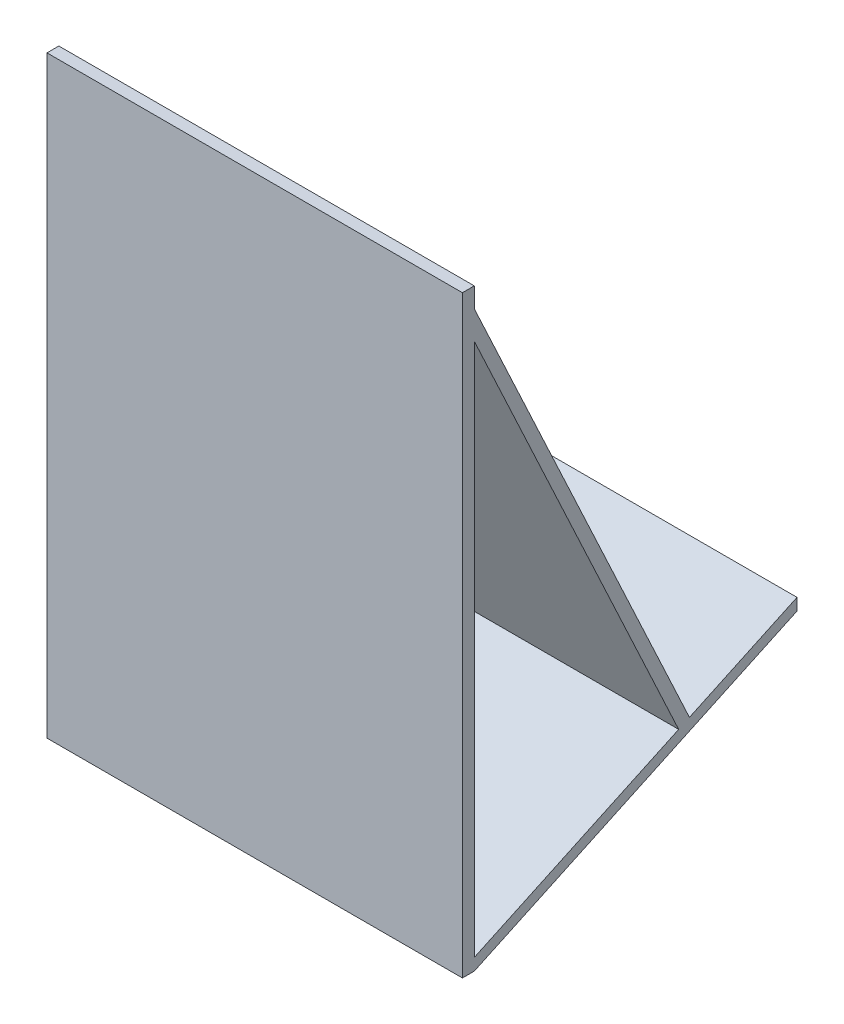
from build123d import *

# Parameters (mm, degrees)
ESBO_O2_W                = 140
ESBO_O2_H                = 200
RESSALTO_EXTRUS_O2_DEPTH = 4
ESBO_O11_W               = 2
ESBO_O11_H               = 4
RESSALTO_EXTRUS_O3_DEPTH = 69
RESSALTO_EXTRUS_O4_DEPTH = 69
ESBO_O14_W               = 140
ESBO_O14_H               = 4
RESSALTO_EXTRUS_O5_DEPTH = 175
ESBO_O17_W               = 140
ESBO_O17_H               = 6
RESSALTO_EXTRUS_O6_DEPTH = 10
ESBO_O18_W               = 140
ESBO_O18_H               = 6
CORTE_EXTRUS_O1_DEPTH    = 10


with BuildPart() as part:
    # Esboço2 → Ressalto-extrusão2 (new body)
    with BuildSketch(Plane.XY):
        Rectangle(ESBO_O2_W, ESBO_O2_H)
    extrude(amount=RESSALTO_EXTRUS_O2_DEPTH)

    # Varredura1: sweep along a curve in space
    with BuildLine() as varredura1_path:
        Line((0, -98, 0), (0, -47.285808591, -108.756934444))
    # Esboço11 → Varredura1 (sweep)
    with BuildSketch(Plane.XY.offset(-108.756934444)):
        with Locations((0, -47.285808591)):
            Rectangle(ESBO_O11_W, ESBO_O11_H)
    sweep(path=varredura1_path.line)

    # Esboço12 → Ressalto-extrusão3 (add)
    with BuildSketch(Plane(origin=(1, 0, 0), x_dir=(0, 0, -1), z_dir=(1, 0, 0))):
        Polygon((108.756934444, -45.285808591), (0, -96), (0, -100), (108.756934444, -49.285808591), align=None)
    extrude(amount=RESSALTO_EXTRUS_O3_DEPTH)

    # Esboço13 → Ressalto-extrusão4 (add)
    with BuildSketch(Plane.ZY.offset(1)):
        Polygon((-108.756934444, -49.285808591), (0, -100), (0, -96), (-108.756934444, -45.285808591), align=None)
    extrude(amount=RESSALTO_EXTRUS_O4_DEPTH)

    # Esboço14 → Ressalto-extrusão5 (add)
    with BuildSketch(Plane(origin=(0, -78.853805265, -36.77013327), x_dir=(1, 0, 0), z_dir=(0, 0.906307787036648, 0.4226182617407039))):
        with Locations((0, 37.428646873)):
            Rectangle(ESBO_O14_W, ESBO_O14_H)
    extrude(amount=RESSALTO_EXTRUS_O5_DEPTH)

    # Esboço17 → Ressalto-extrusão6 (add)
    with BuildSketch(Plane.XY.offset(4)):
        with Locations((0, 93.234832477)):
            Rectangle(ESBO_O17_W, ESBO_O17_H)
    extrude(amount=RESSALTO_EXTRUS_O6_DEPTH)

    # Esboço18 → Corte-extrusão1 (cut)
    with BuildSketch(Plane.XY.offset(14)):
        with Locations((0, 93.234832477)):
            Rectangle(ESBO_O18_W, ESBO_O18_H)
    extrude(amount=-CORTE_EXTRUS_O1_DEPTH, mode=Mode.SUBTRACT)


solid = part.part
